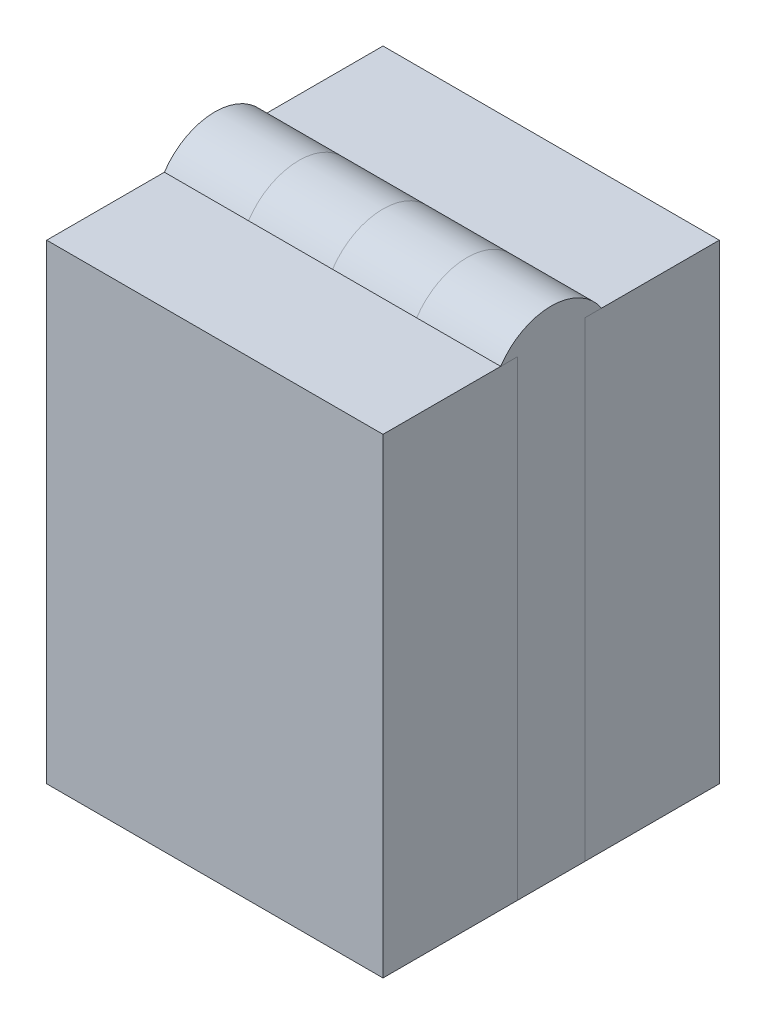
from build123d import *

# Parameters (mm, degrees)
SKETCH1_W             = 2
SKETCH1_H             = 7
BOSS_EXTRUDE1_DEPTH   = 5
BOSS_EXTRUDE1_2_DEPTH = 5
BOSS_EXTRUDE2_DEPTH   = 1.25
BOSS_EXTRUDE3_DEPTH   = 1.25
BOSS_EXTRUDE4_DEPTH   = 1.25
BOSS_EXTRUDE5_DEPTH   = 1.25


with BuildPart() as part:
    # Sketch1 → Boss-Extrude1 (new body)
    with BuildSketch(Plane(origin=(0, 0, 0), x_dir=(0, 0, -1), z_dir=(1, 0, 0))):
        with Locations((-1.5, 0)):
            Rectangle(SKETCH1_W, SKETCH1_H)
    extrude(amount=BOSS_EXTRUDE1_DEPTH)


with BuildPart() as body_2:
    # Sketch1 → Boss-Extrude1 2 (new body)
    with BuildSketch(Plane(origin=(0, 0, 0), x_dir=(0, 0, -1), z_dir=(1, 0, 0))):
        with Locations((1.5, 0)):
            Rectangle(SKETCH1_W, SKETCH1_H)
    extrude(amount=BOSS_EXTRUDE1_2_DEPTH)


with BuildPart() as body_3:
    # Sketch2 → Boss-Extrude2 (new body)
    with BuildSketch(Plane.ZY):
        with BuildLine():
            Line((-0.5, -3.5), (0.5, -3.5))
            Line((0.5, -3.5), (0.5, 3.5))
            Line((0.5, 3.5), (0.75, 3.5))
            ThreePointArc((0.75, 3.5), (0, 3.902238576), (-0.75, 3.5))
            Line((-0.75, 3.5), (-0.5, 3.5))
            Line((-0.5, 3.5), (-0.5, -3.5))
        make_face()
    extrude(amount=-BOSS_EXTRUDE2_DEPTH)


with BuildPart() as body_4:
    # Sketch3 → Boss-Extrude3 (new body)
    with BuildSketch(Plane(origin=(1.25, 0, 0), x_dir=(0, 0, -1), z_dir=(1, 0, 0))):
        with BuildLine():
            Line((-0.75, 3.5), (-0.5, 3.5))
            Line((-0.5, 3.5), (-0.5, -3.5))
            Line((-0.5, -3.5), (0.5, -3.5))
            Line((0.5, -3.5), (0.5, 3.5))
            Line((0.5, 3.5), (0.75, 3.5))
            ThreePointArc((0.75, 3.5), (0, 3.902238576), (-0.75, 3.5))
        make_face()
    extrude(amount=BOSS_EXTRUDE3_DEPTH)


with BuildPart() as body_5:
    # Sketch4 → Boss-Extrude4 (new body)
    with BuildSketch(Plane(origin=(2.5, 0, 0), x_dir=(0, 0, -1), z_dir=(1, 0, 0))):
        with BuildLine():
            Line((-0.75, 3.5), (-0.5, 3.5))
            Line((-0.5, 3.5), (-0.5, -3.5))
            Line((-0.5, -3.5), (0.5, -3.5))
            Line((0.5, -3.5), (0.5, 3.5))
            Line((0.5, 3.5), (0.75, 3.5))
            ThreePointArc((0.75, 3.5), (0, 3.902238576), (-0.75, 3.5))
        make_face()
    extrude(amount=BOSS_EXTRUDE4_DEPTH)


with BuildPart() as body_6:
    # Sketch5 → Boss-Extrude5 (new body)
    with BuildSketch(Plane(origin=(3.75, 0, 0), x_dir=(0, 0, -1), z_dir=(1, 0, 0))):
        with BuildLine():
            Line((-0.75, 3.5), (-0.5, 3.5))
            Line((-0.5, 3.5), (-0.5, -3.5))
            Line((-0.5, -3.5), (0.5, -3.5))
            Line((0.5, -3.5), (0.5, 3.5))
            Line((0.5, 3.5), (0.75, 3.5))
            ThreePointArc((0.75, 3.5), (0, 3.902238576), (-0.75, 3.5))
        make_face()
    extrude(amount=BOSS_EXTRUDE5_DEPTH)


solid = Compound([part.part, body_2.part, body_3.part, body_4.part, body_5.part, body_6.part])
